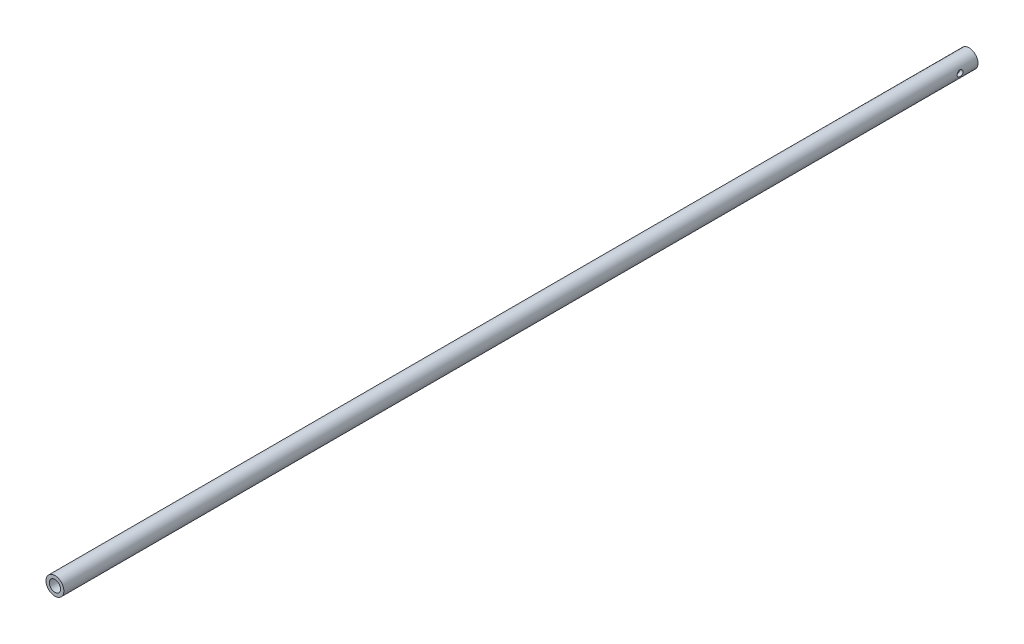
from build123d import *

# Parameters (mm, degrees)
SKETCH1_R               = 2.3876
SKETCH1_R_2             = 1.4986
BOSS_EXTRUDE1_DEPTH     = 243.84
CUT_EXTRUDE1_DEPTH      = 244.863377463
CUT_EXTRUDE1_DEPTH_BACK = 244.863377463
SKETCH2_R               = 0.79375


with BuildPart() as part:
    # Sketch1 → Boss-Extrude1 (new body)
    with BuildSketch(Plane.XY):
        with Locations(Location((0, 0, 0), (0, 0, 180))):
            Circle(SKETCH1_R)
        with Locations(Location((0, 0, 0), (0, 0, 180))):
            Circle(SKETCH1_R_2, mode=Mode.SUBTRACT)
    extrude(amount=BOSS_EXTRUDE1_DEPTH)

    # Sketch2 → Cut-Extrude1 (cut, two sides: drawn at the far end of the back side and taken through both)
    with BuildSketch(Plane(origin=(0, 0, 0), x_dir=(0, 0, -1), z_dir=(1, 0, 0)).offset(-CUT_EXTRUDE1_DEPTH_BACK)):
        with Locations((-4.7625, 0)):
            Circle(SKETCH2_R)
    extrude(amount=CUT_EXTRUDE1_DEPTH + CUT_EXTRUDE1_DEPTH_BACK, mode=Mode.SUBTRACT)


solid = part.part
